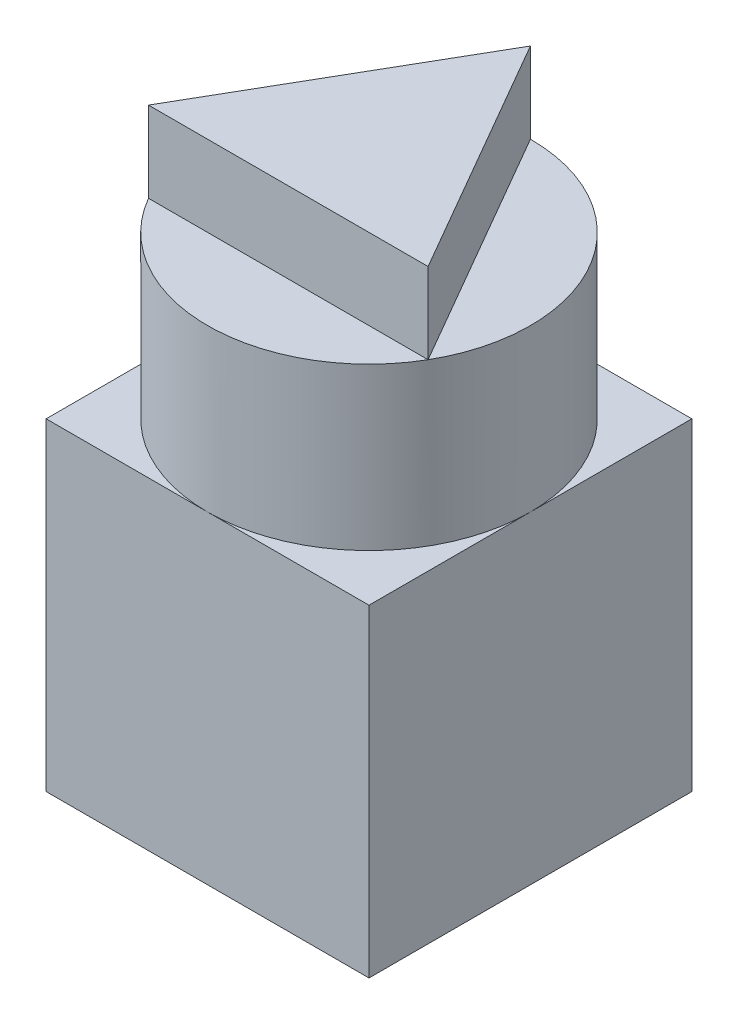
from build123d import *

# Parameters (mm, degrees)
SKETCH1_W           = 200
SKETCH1_H           = 200
BOSS_EXTRUDE2_DEPTH = 200
SKETCH3_R           = 100
BOSS_EXTRUDE3_DEPTH = 100
BOSS_EXTRUDE4_DEPTH = 50


with BuildPart() as part:
    # Sketch1 → Boss-Extrude2 (new body)
    with BuildSketch(Plane(origin=(0, 0, 0), x_dir=(1, 0, 0), z_dir=(0, 1, 0))):
        Rectangle(SKETCH1_W, SKETCH1_H)
    extrude(amount=BOSS_EXTRUDE2_DEPTH)

    # Sketch3 → Boss-Extrude3 (add)
    with BuildSketch(Plane(origin=(0, 200, 0), x_dir=(1, 0, 0), z_dir=(0, 1, 0))):
        with Locations(Location((0, 0, 0), (0, 0, 270))):
            Circle(SKETCH3_R)
    extrude(amount=BOSS_EXTRUDE3_DEPTH)

    # Sketch4 → Boss-Extrude4 (add)
    with BuildSketch(Plane(origin=(0, 300, 0), x_dir=(1, 0, 0), z_dir=(0, 1, 0))):
        Polygon((0, 100), (-86.602540378, -50), (86.602540378, -50), align=None)
    extrude(amount=BOSS_EXTRUDE4_DEPTH)


solid = part.part
